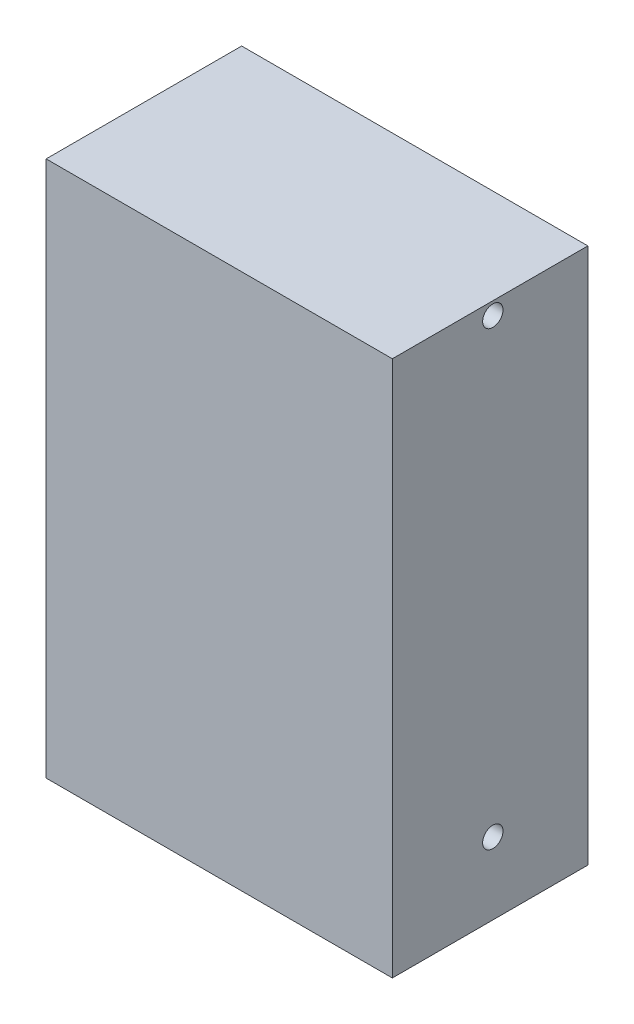
from build123d import *

# Parameters (mm, degrees)
SKETCH_1_W          = 51
SKETCH_1_H          = 79
EXTRUDE_1_DEPTH     = 28.8
SKETCH_2_R          = 1.5
CUT_EXTRUDE_1_DEPTH = 5
SKETCH_3_R          = 1.5
CUT_EXTRUDE_2_DEPTH = 5
SKETCH_4_W          = 41
SKETCH_4_H          = 12
CUT_EXTRUDE_3_DEPTH = 5


with BuildPart() as part:
    # 草图1 → 凸台-拉伸1 (new body)
    with BuildSketch(Plane.XY):
        Rectangle(SKETCH_1_W, SKETCH_1_H)
    extrude(amount=EXTRUDE_1_DEPTH)

    # 草图2 → 切除-拉伸1 (cut)
    with BuildSketch(Plane(origin=(0, 0, 0), x_dir=(-1, 0, 0), z_dir=(0, 0, -1))):
        with Locations((0, 29)):
            Circle(SKETCH_2_R)
        with Locations((0, -26)):
            Circle(SKETCH_2_R)
    extrude(amount=-CUT_EXTRUDE_1_DEPTH, mode=Mode.SUBTRACT)

    # 草图3 → 切除-拉伸2 (cut)
    with BuildSketch(Plane(origin=(25.5, 0, 0), x_dir=(0, 0, -1), z_dir=(1, 0, 0))):
        with Locations(Location((-14, 37.6, 0), (0, 0, 90))):
            Circle(SKETCH_3_R)
        with Locations(Location((-14, -28.9, 0), (0, 0, 90))):
            Circle(SKETCH_3_R)
    extrude(amount=-CUT_EXTRUDE_2_DEPTH, mode=Mode.SUBTRACT)

    # 草图4 → 切除-拉伸3 (cut)
    with BuildSketch(Plane.XZ.offset(39.5)):
        with Locations((-5, 11)):
            Rectangle(SKETCH_4_W, SKETCH_4_H)
    extrude(amount=-CUT_EXTRUDE_3_DEPTH, mode=Mode.SUBTRACT)


solid = part.part
